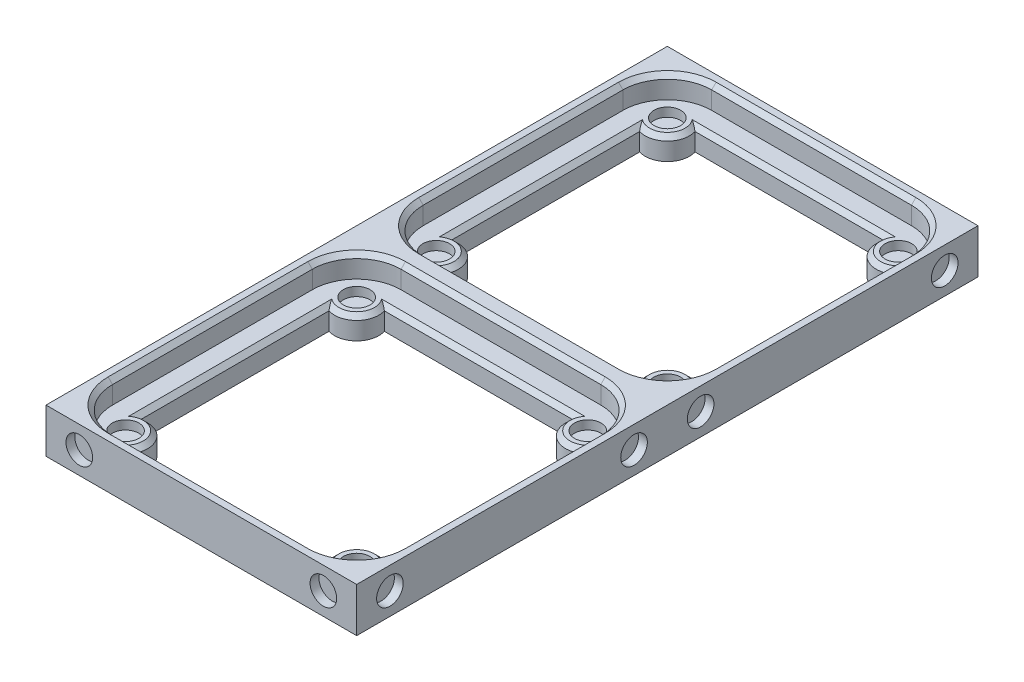
from build123d import *

# Parameters (mm, degrees)
SKETCH1_W               = 70
SKETCH1_H               = 70
BOSS_EXTRUDE2_DEPTH     = 7
CUT_EXTRUDE1_DEPTH      = 5
SKETCH9_W               = 70
SKETCH9_H               = 70
BOSS_EXTRUDE3_DEPTH     = 5
CUT_EXTRUDE11_DEPTH     = 100.242128151
SKETCH21_R              = 3
CUT_EXTRUDE12_DEPTH     = 2
CHAMFER3_SIZE           = 1
CUT_EXTRUDE13_START     = -2
SKETCH22_W              = 70
SKETCH22_H              = 70
CUT_EXTRUDE13_DEPTH     = 2
SKETCH27_R              = 3
CUT_EXTRUDE27_DEPTH     = 2
SKETCH28_R              = 3
CUT_EXTRUDE28_DEPTH     = 2
MIRROR8_COPY_1_SKETCH_R = 3
MIRROR8_COPY_1_DEPTH    = 2
MIRROR8_COPY_2_SKETCH_R = 3
MIRROR8_COPY_2_DEPTH    = 2


with BuildPart() as part:
    # Sketch1 → Boss-Extrude2 (new body)
    with BuildSketch(Plane(origin=(0, 0, 0), x_dir=(1, 0, 0), z_dir=(0, 1, 0))):
        with Locations((35, 35)):
            Rectangle(SKETCH1_W, SKETCH1_H)
    extrude(amount=BOSS_EXTRUDE2_DEPTH)

    # Sketch3 → Cut-Extrude1 (cut)
    with BuildSketch(Plane(origin=(0, 7, 0), x_dir=(1, 0, 0), z_dir=(0, 1, 0))):
        with BuildLine():
            Line((2.5, 57.5), (2.5, 12.5))
            ThreePointArc((2.5, 12.5), (5.428932188, 5.428932188), (12.5, 2.5))
            Line((12.5, 2.5), (57.5, 2.5))
            ThreePointArc((57.5, 2.5), (64.571067812, 5.428932188), (67.5, 12.5))
            Line((67.5, 12.5), (67.5, 57.5))
            ThreePointArc((67.5, 57.5), (64.571067812, 64.571067812), (57.5, 67.5))
            Line((57.5, 67.5), (12.5, 67.5))
            ThreePointArc((12.5, 67.5), (5.428932188, 64.571067812), (2.5, 57.5))
        make_face()
    extrude(amount=-CUT_EXTRUDE1_DEPTH, mode=Mode.SUBTRACT)

    # Sketch9 → Boss-Extrude3 (add)
    with BuildSketch(Plane.XZ):
        with Locations((35, -35)):
            Rectangle(SKETCH9_W, SKETCH9_H)
    extrude(amount=BOSS_EXTRUDE3_DEPTH)

    # Sketch20 → Cut-Extrude11 (cut, through all)
    with BuildSketch(Plane(origin=(0, 2, 0), x_dir=(1, 0, 0), z_dir=(0, 1, 0))):
        with BuildLine():
            Line((13.745191882, 7.5), (56.254808118, 7.5))
            ThreePointArc((56.254808118, 7.5), (57.5, 12.5), (62.5, 13.745191882))
            Line((62.5, 13.745191882), (62.5, 56.254808118))
            ThreePointArc((62.5, 56.254808118), (57.5, 57.5), (56.254808118, 62.5))
            Line((56.254808118, 62.5), (13.745191882, 62.5))
            ThreePointArc((13.745191882, 62.5), (12.5, 57.5), (7.5, 56.254808118))
            Line((7.5, 56.254808118), (7.5, 13.745191882))
            ThreePointArc((7.5, 13.745191882), (12.5, 12.5), (13.745191882, 7.5))
        make_face()
    extrude(amount=-CUT_EXTRUDE11_DEPTH, mode=Mode.SUBTRACT)

    # Sketch21 → Cut-Extrude12 (cut)
    with BuildSketch(Plane(origin=(0, 2, 0), x_dir=(1, 0, 0), z_dir=(0, 1, 0))):
        with Locations(Location((8.964466094, 61.035533906, 0), (0, 0, 270))):
            Circle(SKETCH21_R)
        with Locations(Location((61.035533906, 61.035533906, 0), (0, 0, 270))):
            Circle(SKETCH21_R)
        with Locations(Location((61.035533906, 8.964466094, 0), (0, 0, 270))):
            Circle(SKETCH21_R)
        with Locations(Location((8.964466094, 8.964466094, 0), (0, 0, 270))):
            Circle(SKETCH21_R)
    extrude(amount=-CUT_EXTRUDE12_DEPTH, mode=Mode.SUBTRACT)

    # Chamfer3
    chamfer3_edges = [part.edges().sort_by_distance(p)[0] for p in [
        (5.428932188, 7, -5.428932188),
        (35, 7, -2.5),
        (64.571067812, 7, -5.428932188),
        (67.5, 7, -35),
        (64.571067812, 7, -64.571067812),
        (35, 7, -67.5),
        (5.428932188, 7, -64.571067812),
        (2.5, 7, -35),
        (12.5, 2, -12.5),
        (12.5, 2, -57.5),
        (57.5, 2, -57.5),
        (57.5, 2, -12.5),
        (35, 2, -7.5),
        (62.5, 2, -35),
        (35, 2, -62.5),
        (7.5, 2, -35),
    ]]
    chamfer(chamfer3_edges, length=CHAMFER3_SIZE)

    # Sketch22 → Cut-Extrude13 (cut)
    with BuildSketch(Plane.XZ.offset(5).offset(CUT_EXTRUDE13_START)):
        with Locations((35, -35)):
            Rectangle(SKETCH22_W, SKETCH22_H)
        with BuildLine():
            Line((7.5, -13.745191882), (7.5, -56.254808118))
            ThreePointArc((7.5, -56.254808118), (12.5, -57.5), (13.745191882, -62.5))
            Line((13.745191882, -62.5), (56.254808118, -62.5))
            ThreePointArc((56.254808118, -62.5), (57.5, -57.5), (62.5, -56.254808118))
            Line((62.5, -56.254808118), (62.5, -13.745191882))
            ThreePointArc((62.5, -13.745191882), (57.5, -12.5), (56.254808118, -7.5))
            Line((56.254808118, -7.5), (13.745191882, -7.5))
            ThreePointArc((13.745191882, -7.5), (12.5, -12.5), (7.5, -13.745191882))
        make_face(mode=Mode.SUBTRACT)
    extrude(amount=CUT_EXTRUDE13_DEPTH, mode=Mode.SUBTRACT)

    # Sketch27 → Cut-Extrude27 (cut)
    with BuildSketch(Plane.ZY):
        with Locations((-62.5, 2)):
            Circle(SKETCH27_R)
        with Locations((-7.5, 2)):
            Circle(SKETCH27_R)
    cut_extrude27 = extrude(amount=-CUT_EXTRUDE27_DEPTH, mode=Mode.SUBTRACT)

    # Sketch28 → Cut-Extrude28 (cut)
    with BuildSketch(Plane.XY):
        with Locations((7.5, 2)):
            Circle(SKETCH28_R)
        with Locations((62.5, 2)):
            Circle(SKETCH28_R)
    extrude(amount=-CUT_EXTRUDE28_DEPTH, mode=Mode.SUBTRACT)

    # Mirror2: part across plane


with BuildPart() as part_1:
    add(part.part)
    add(part.part.mirror(Plane(origin=(0, 7, -70), x_dir=(1, 0, 0), z_dir=(0, 0, 1))))

    # Mirror7: Cut-Extrude27 across plane
    add(cut_extrude27.mirror(Plane.ZY.offset(-35)), mode=Mode.SUBTRACT)

    # Mirror8 copy 1 sketch → Mirror8 copy 1 (cut)
    with BuildSketch(Plane(origin=(70, 0, -140), x_dir=(0, 0, -1), z_dir=(1, 0, 0))):
        with Locations((-62.5, 2)):
            Circle(MIRROR8_COPY_1_SKETCH_R)
        with Locations((-7.5, 2)):
            Circle(MIRROR8_COPY_1_SKETCH_R)
    extrude(amount=-MIRROR8_COPY_1_DEPTH, mode=Mode.SUBTRACT)

    # Mirror8 copy 2 sketch → Mirror8 copy 2 (cut)
    with BuildSketch(Plane(origin=(0, 0, -140), x_dir=(0, 0, -1), z_dir=(-1, 0, 0))):
        with Locations((-62.5, -2)):
            Circle(MIRROR8_COPY_2_SKETCH_R)
        with Locations((-7.5, -2)):
            Circle(MIRROR8_COPY_2_SKETCH_R)
    extrude(amount=-MIRROR8_COPY_2_DEPTH, mode=Mode.SUBTRACT)


solid = part_1.part
